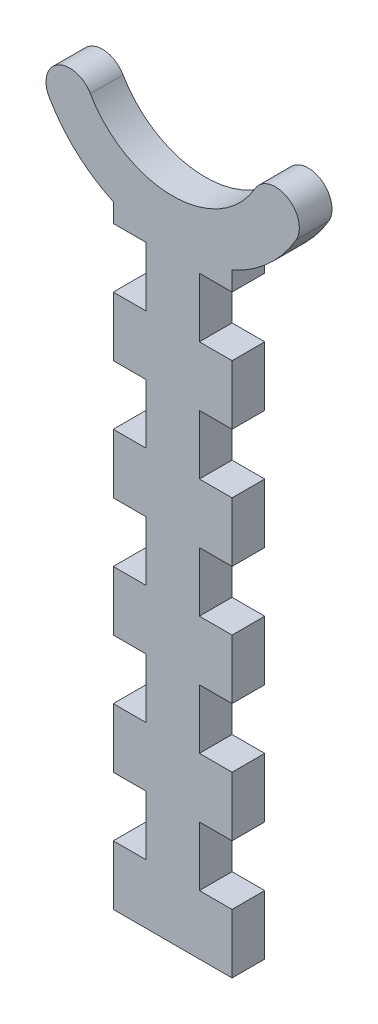
from build123d import *

# Parameters (mm, degrees)
EXTRUDE_1_DEPTH     = 5.5
SKETCH_2_W          = 5.5
SKETCH_2_H          = 10
CUT_EXTRUDE_1_DEPTH = 127.924442345


with BuildPart() as part:
    # ｽｹｯﾁ1 → ﾎﾞｽ - 押し出し1 (new body)
    with BuildSketch(Plane.XY):
        with BuildLine():
            Line((-10, -21.817424229), (-10, -125))
            Line((-10, -125), (10, -125))
            Line((10, -125), (10, -21.817424229))
            ThreePointArc((10, -21.817424229), (16.156067067, -17.747718076), (20.784609691, -12))
            ThreePointArc((20.784609691, -12), (19.320508076, -6.535898385), (13.856406461, -8))
            ThreePointArc((13.856406461, -8), (0, -16), (-13.856406461, -8))
            ThreePointArc((-13.856406461, -8), (-19.320508076, -6.535898385), (-20.784609691, -12))
            ThreePointArc((-20.784609691, -12), (-16.156067067, -17.747718076), (-10, -21.817424229))
        make_face()
    extrude(amount=EXTRUDE_1_DEPTH)

    # ｽｹｯﾁ2 → ｶｯﾄ - 押し出し1 (cut, through all)
    with BuildSketch(Plane.XY.offset(5.5)):
        with Locations((-7.25, -90)):
            Rectangle(SKETCH_2_W, SKETCH_2_H)
        with Locations((-7.25, -110)):
            Rectangle(SKETCH_2_W, SKETCH_2_H)
        with Locations((-7.25, -70)):
            Rectangle(SKETCH_2_W, SKETCH_2_H)
        with Locations((-7.25, -50)):
            Rectangle(SKETCH_2_W, SKETCH_2_H)
        with Locations((-7.25, -30)):
            Rectangle(SKETCH_2_W, SKETCH_2_H)
        with Locations((7.25, -110)):
            Rectangle(SKETCH_2_W, SKETCH_2_H)
        with Locations((7.25, -90)):
            Rectangle(SKETCH_2_W, SKETCH_2_H)
        with Locations((7.25, -70)):
            Rectangle(SKETCH_2_W, SKETCH_2_H)
        with Locations((7.25, -50)):
            Rectangle(SKETCH_2_W, SKETCH_2_H)
        with Locations((7.25, -30)):
            Rectangle(SKETCH_2_W, SKETCH_2_H)
    extrude(amount=-CUT_EXTRUDE_1_DEPTH, mode=Mode.SUBTRACT)


solid = part.part
